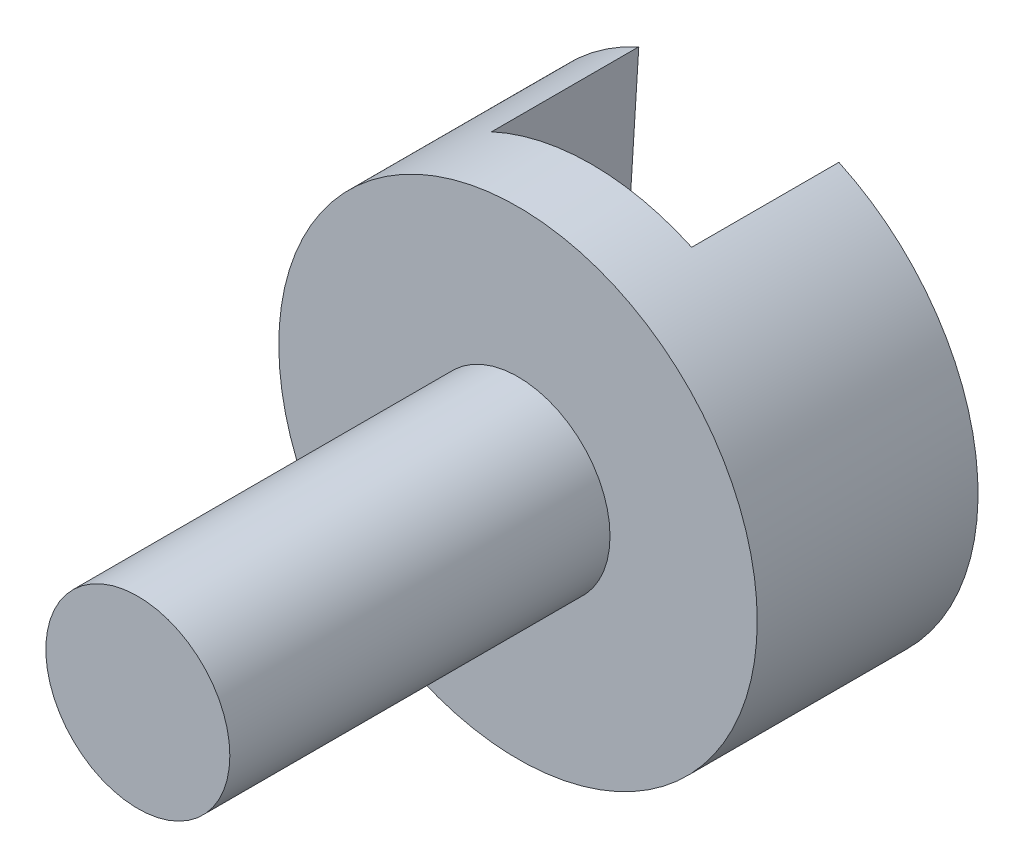
from build123d import *

# Parameters (mm, degrees)
SKETCH4_R           = 6.5
BOSS_EXTRUDE1_DEPTH = 6
CUT_EXTRUDE2_DEPTH  = 4
SKETCH7_R           = 2.5
BOSS_EXTRUDE2_DEPTH = 10.33


with BuildPart() as part:
    # Sketch4 → Boss-Extrude1 (new body)
    with BuildSketch(Plane.XY):
        Circle(SKETCH4_R)
    extrude(amount=BOSS_EXTRUDE1_DEPTH)

    # Sketch6 → Cut-Extrude2 (cut)
    with BuildSketch(Plane.XY):
        with BuildLine():
            Line((2.945810333, 2.23879465), (2.718410219, 5.90425659))
            ThreePointArc((2.718410219, 5.90425659), (0, 6.5), (-2.718410219, 5.90425659))
            Line((-2.718410219, 5.90425659), (-2.945810333, 2.23879465))
            ThreePointArc((-2.945810333, 2.23879465), (0, -3.7), (2.945810333, 2.23879465))
        make_face()
    extrude(amount=CUT_EXTRUDE2_DEPTH, mode=Mode.SUBTRACT)

    # Sketch7 → Boss-Extrude2 (add)
    with BuildSketch(Plane.XY.offset(6)):
        Circle(SKETCH7_R)
    extrude(amount=BOSS_EXTRUDE2_DEPTH)


solid = part.part
